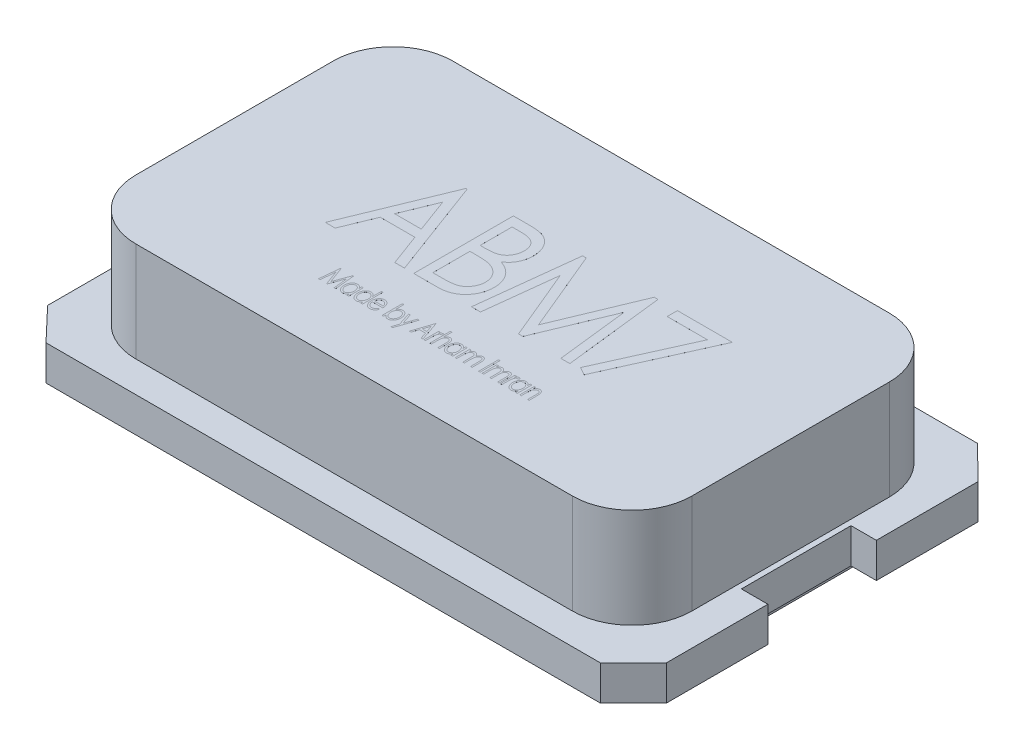
from build123d import *

# Parameters (mm, degrees)
SKETCH2_W             = 1.60281389
SKETCH2_H             = 2
BOSS_EXTRUDE3_DEPTH   = 0.05
BOSS_EXTRUDE3_2_DEPTH = 0.05
SKETCH2_6_W           = 1.60281389
SKETCH2_6_H           = 2
BOSS_EXTRUDE4_DEPTH   = 0.35
SKETCH4_W             = 1.60281389
SKETCH4_H             = 2
BOSS_EXTRUDE5_DEPTH   = 0.35
BOSS_EXTRUDE6_DEPTH   = 1
BOSS_EXTRUDE7_DEPTH   = 0.0001
SKETCH7_W             = 0.015384615
SKETCH7_H             = 0.2
BOSS_EXTRUDE8_DEPTH   = 0.0001


with BuildPart() as part:
    # Sketch2 → Boss-Extrude3 (new body)
    with BuildSketch(Plane(origin=(0, 0, 0), x_dir=(1, 0, 0), z_dir=(0, 1, 0))):
        with Locations((-2.017592262, -0.002943306)):
            Rectangle(SKETCH2_W, SKETCH2_H)
    extrude(amount=-BOSS_EXTRUDE3_DEPTH)



with BuildPart() as body_2:
    # Sketch2 → Boss-Extrude3 2 (new body)
    with BuildSketch(Plane(origin=(0, 0, 0), x_dir=(1, 0, 0), z_dir=(0, 1, 0))):
        with Locations((2.012956796, -0.000677208)):
            Rectangle(SKETCH2_W, SKETCH2_H)
    extrude(amount=-BOSS_EXTRUDE3_2_DEPTH)


with BuildPart() as body_3:
    # Sketch2<6> → Boss-Extrude4 (new body)
    with BuildSketch(Plane(origin=(0, 0, 0), x_dir=(1, 0, 0), z_dir=(0, 1, 0))):
        Polygon((-2.766899596, 1.9), (2.765342962, 1.9), (3.1, 1.569992929), (3.1, 0.55), (2.845363741, 0.55), (2.845363741, -0.55), (3.111544747, -0.55), (3.111544747, -1.57), (2.781544747, -1.9), (-2.783101382, -1.9), (-3.099891164, -1.566870993), (-3.099891164, -0.546870993), (-2.849999207, -0.546870993), (-2.849999207, 0.553129007), (-3.099999207, 0.553129002), (-3.099999207, 1.573129002), align=None)
        with Locations((-2.017592262, -0.002943306)):
            Rectangle(SKETCH2_6_W, SKETCH2_6_H, mode=Mode.SUBTRACT)
        with Locations((2.012956796, -0.000677208)):
            Rectangle(SKETCH2_6_W, SKETCH2_6_H, mode=Mode.SUBTRACT)
    extrude(amount=BOSS_EXTRUDE4_DEPTH)


with BuildPart() as part_1:
    add(part.part)

    add(body_2.part)  # Boss-Extrude5 merges body 2

    add(body_3.part)  # Boss-Extrude5 merges body 3
    # Sketch4 → Boss-Extrude5 (add)
    with BuildSketch(Plane(origin=(0, 0, 0), x_dir=(1, 0, 0), z_dir=(0, 1, 0))):
        with Locations((-2.017592262, -0.002943306)):
            Rectangle(SKETCH4_W, SKETCH4_H)
        with Locations((2.012956796, -0.000677208)):
            Rectangle(SKETCH4_W, SKETCH4_H)
    extrude(amount=BOSS_EXTRUDE5_DEPTH)

    # Sketch5 → Boss-Extrude6 (add)
    with BuildSketch(Plane(origin=(0, 0.35, 0), x_dir=(1, 0, 0), z_dir=(0, 1, 0))):
        with BuildLine():
            Line((-2.190920375, 1.59), (2.189363741, 1.59))
            ThreePointArc((2.189363741, 1.59), (2.61362781, 1.414264069), (2.789363741, 0.99))
            Line((2.789363741, 0.99), (2.789363741, -0.99))
            ThreePointArc((2.789363741, -0.99), (2.61362781, -1.414264069), (2.189363741, -1.59))
            Line((2.189363741, -1.59), (-2.190920375, -1.59))
            ThreePointArc((-2.190920375, -1.59), (-2.615184444, -1.414264069), (-2.790920375, -0.99))
            Line((-2.790920375, -0.99), (-2.790920375, 0.99))
            ThreePointArc((-2.790920375, 0.99), (-2.615184444, 1.414264069), (-2.190920375, 1.59))
        make_face()
    extrude(amount=BOSS_EXTRUDE6_DEPTH)

    # Sketch6 → Boss-Extrude7 (add)
    # profile 1 of 4: a face of its own
    with BuildSketch(Plane(origin=(0, 1.35, 0), x_dir=(1, 0, 0), z_dir=(0, 1, 0))):
        Polygon((-1.004768688, 0.547814016), (-0.632973816, -0.452185984), (-0.730329586, -0.452185984), (-0.84931997, -0.131673164), (-1.197477022, -0.131673164), (-1.328887278, -0.452185984), (-1.427845611, -0.452185984), (-1.017589201, 0.547814016), align=None)
        Polygon((-1.014784714, 0.313238695), (-1.155209393, -0.029109061), (-0.887581188, -0.029109061), align=None, mode=Mode.SUBTRACT)
    # profile 2 of 4: a face of its own
    with BuildSketch(Plane(origin=(0, 1.35, 0), x_dir=(1, 0, 0), z_dir=(0, 1, 0))):
        with BuildLine():
            Line((-0.540666124, 0.547814016), (-0.369993047, 0.547814016))
            add(Edge.make_bspline(
                [(-0.369993047, 0.547814016), (-0.361643741, 0.547762066), (-0.345399843, 0.547660997), (-0.321816103, 0.546166278), (-0.299735854, 0.544096142), (-0.279221729, 0.5408361), (-0.26016035, 0.536853016), (-0.242504845, 0.532152414), (-0.226347972, 0.526327791), (-0.206986598, 0.51728618), (-0.184919674, 0.503556166), (-0.161007022, 0.483566033), (-0.140609284, 0.459187762), (-0.123233782, 0.431524412), (-0.109333019, 0.401270873), (-0.099191173, 0.36898478), (-0.093070237, 0.335039209), (-0.092325508, 0.311794801), (-0.091948175, 0.300017541)],
                knots=[0, 0, 0, 0, 0.943162248, 1.8349585, 2.668974122, 3.447905888, 4.180328077, 4.868477066, 5.51045498, 6.117996276, 7.27997042, 8.436248577, 9.624427036, 10.855171045, 12.117669478, 13.375131133, 14.670055953, 16, 16, 16, 16], degree=3))
            add(Edge.make_bspline(
                [(-0.091948175, 0.300017541), (-0.092298031, 0.288979547), (-0.092984813, 0.267311489), (-0.098304413, 0.235550518), (-0.107157689, 0.205374639), (-0.119318226, 0.176838134), (-0.135033232, 0.150387105), (-0.15415621, 0.126453097), (-0.176654083, 0.105022476), (-0.193801738, 0.093260641), (-0.202525098, 0.087277157)],
                knots=[0, 0, 0, 0, 1.056727506, 2.074401545, 3.074053978, 4.06237172, 5.037358539, 6.011107225, 6.988209916, 8, 8, 8, 8], degree=3))
            add(Edge.make_bspline(
                [(-0.202525098, 0.087277157), (-0.191498188, 0.082911857), (-0.170360329, 0.074543867), (-0.141259083, 0.05977712), (-0.116132416, 0.04377158), (-0.094879174, 0.026257901), (-0.076870337, 0.007217369), (-0.060708473, -0.013103677), (-0.047290607, -0.035685714), (-0.035514963, -0.059724391), (-0.026438807, -0.085281101), (-0.019656603, -0.112013875), (-0.015933412, -0.139847995), (-0.015329912, -0.158773146), (-0.015025098, -0.168331818)],
                knots=[0, 0, 0, 0, 1.253473359, 2.402825568, 3.44468963, 4.397487603, 5.306318866, 6.211633052, 7.136718514, 8.0777245, 9.038026576, 9.998665997, 10.989170872, 12, 12, 12, 12], degree=3))
            add(Edge.make_bspline(
                [(-0.015025098, -0.168331818), (-0.015247524, -0.178092115), (-0.015684808, -0.197280683), (-0.019385332, -0.225446563), (-0.025377425, -0.252408107), (-0.033783661, -0.278296664), (-0.044986042, -0.302922456), (-0.058044909, -0.326752377), (-0.074187634, -0.348965885), (-0.091955903, -0.3701767), (-0.112015559, -0.389402621), (-0.133821437, -0.406342021), (-0.157533095, -0.420375221), (-0.182711715, -0.432139416), (-0.209679007, -0.441131279), (-0.238288154, -0.447421531), (-0.26843845, -0.451650057), (-0.289115358, -0.452004749), (-0.299680547, -0.452185984)],
                knots=[0, 0, 0, 0, 1.038509558, 2.041690987, 3.017614995, 3.975041845, 4.932626952, 5.89352943, 6.861815316, 7.850082867, 8.835279032, 9.81329694, 10.782286797, 11.761646577, 12.766261968, 13.800775556, 14.87627195, 16, 16, 16, 16], degree=3))
            Line((-0.299680547, -0.452185984), (-0.540666124, -0.452185984))
            Line((-0.540666124, -0.452185984), (-0.540666124, 0.547814016))
        make_face()
        with BuildLine():
            Line((-0.450922534, 0.445249913), (-0.450922534, 0.124737093))
            Line((-0.450922534, 0.124737093), (-0.40224465, 0.124737093))
            add(Edge.make_bspline(
                [(-0.40224465, 0.124737093), (-0.395099974, 0.12484974), (-0.381340567, 0.12506668), (-0.361348008, 0.125719725), (-0.342860918, 0.127452829), (-0.325777948, 0.129269493), (-0.310269049, 0.132115223), (-0.29625868, 0.135564979), (-0.283501764, 0.139207418), (-0.268730333, 0.145401569), (-0.251891385, 0.154532662), (-0.234357329, 0.168920575), (-0.218703679, 0.18566477), (-0.205593918, 0.205123339), (-0.195031249, 0.226573598), (-0.187117883, 0.249346017), (-0.182672432, 0.273470748), (-0.182023261, 0.289850441), (-0.181691765, 0.298214657)],
                knots=[0, 0, 0, 0, 1.068645243, 2.058025688, 2.990115549, 3.844744776, 4.626241161, 5.345550605, 6.002630039, 6.607150377, 7.738038243, 8.853076426, 9.983611551, 11.155164805, 12.347513366, 13.550642837, 14.749246986, 16, 16, 16, 16], degree=3))
            add(Edge.make_bspline(
                [(-0.181691765, 0.298214657), (-0.181784676, 0.30376349), (-0.181966667, 0.314632414), (-0.184045046, 0.330447628), (-0.18725326, 0.345390311), (-0.191574916, 0.359479782), (-0.197440487, 0.372550367), (-0.204538082, 0.384670203), (-0.212731054, 0.395998384), (-0.222450967, 0.406265798), (-0.233511102, 0.415514696), (-0.246024286, 0.423669627), (-0.260230325, 0.430107804), (-0.275694036, 0.435894855), (-0.292886864, 0.439889208), (-0.311456981, 0.443190585), (-0.331566132, 0.444911647), (-0.345417744, 0.445134778), (-0.352565163, 0.445249913)],
                knots=[0, 0, 0, 0, 1.033315509, 2.02403391, 2.965976521, 3.878877932, 4.764409291, 5.628620732, 6.492115432, 7.363461866, 8.255524103, 9.173498167, 10.136325718, 11.155690621, 12.24501133, 13.419065984, 14.668240628, 16, 16, 16, 16], degree=3))
            Line((-0.352565163, 0.445249913), (-0.450922534, 0.445249913))
        make_face(mode=Mode.SUBTRACT)
        with BuildLine():
            Line((-0.450922534, 0.02217299), (-0.450922534, -0.349621882))
            Line((-0.450922534, -0.349621882), (-0.342949778, -0.349621882))
            add(Edge.make_bspline(
                [(-0.342949778, -0.349621882), (-0.335270441, -0.349512331), (-0.320442073, -0.349300794), (-0.298988461, -0.348606206), (-0.279060068, -0.347046792), (-0.260779262, -0.344556103), (-0.244006906, -0.341926193), (-0.228919357, -0.338227325), (-0.215341983, -0.334171572), (-0.199491969, -0.327687898), (-0.181603702, -0.317791959), (-0.162609951, -0.302644863), (-0.14552896, -0.284945641), (-0.131334777, -0.264229668), (-0.119513461, -0.241888117), (-0.111097588, -0.218131729), (-0.105566358, -0.193560066), (-0.105035645, -0.176774983), (-0.104768688, -0.168331818)],
                knots=[0, 0, 0, 0, 1.081619098, 2.088545823, 3.022572722, 3.895065755, 4.686620152, 5.411945446, 6.081214222, 6.68019563, 7.821024448, 8.946046415, 10.090087698, 11.271885441, 12.47066001, 13.639667357, 14.812714956, 16, 16, 16, 16], degree=3))
            add(Edge.make_bspline(
                [(-0.104768688, -0.168331818), (-0.10519011, -0.157867245), (-0.106017209, -0.137329062), (-0.113750604, -0.107703368), (-0.126100963, -0.080121918), (-0.143519977, -0.055116464), (-0.164919818, -0.032787869), (-0.190409865, -0.014145396), (-0.219577646, 0.000706384), (-0.240862873, 0.007078614), (-0.251803945, 0.01035408)],
                knots=[0, 0, 0, 0, 1.002523699, 1.967592627, 2.916812078, 3.889001818, 4.876880315, 5.871365521, 6.905835296, 8, 8, 8, 8], degree=3))
            add(Edge.make_bspline(
                [(-0.251803945, 0.01035408), (-0.255732825, 0.011338995), (-0.264199466, 0.013461463), (-0.27813212, 0.015765134), (-0.294039201, 0.017738364), (-0.311955509, 0.019241186), (-0.331776836, 0.020777611), (-0.353698723, 0.021385775), (-0.377600811, 0.022092085), (-0.394231095, 0.022145382), (-0.402845611, 0.02217299)],
                knots=[0, 0, 0, 0, 0.639967164, 1.379113422, 2.229991931, 3.173071501, 4.220511108, 5.371654984, 6.638512572, 8, 8, 8, 8], degree=3))
            Line((-0.402845611, 0.02217299), (-0.450922534, 0.02217299))
        make_face(mode=Mode.SUBTRACT)
    # profile 3 of 4: a face of its own
    with BuildSketch(Plane(origin=(0, 1.35, 0), x_dir=(1, 0, 0), z_dir=(0, 1, 0))):
        Polygon((0.038821055, -0.452185984), (0.15380503, 0.547814016), (0.190263363, 0.547814016), (0.532410799, -0.272698805), (0.873155991, 0.547814016), (0.910816248, 0.547814016), (1.026000543, -0.452185984), (0.935655991, -0.452185984), (0.85292362, 0.265762734), (0.554846696, -0.452185984), (0.511176825, -0.452185984), (0.211897978, 0.265762734), (0.129365927, -0.452185984), align=None)
    # profile 4 of 4: a face of its own
    with BuildSketch(Plane(origin=(0, 1.35, 0), x_dir=(1, 0, 0), z_dir=(0, 1, 0))):
        Polygon((1.105487722, 0.547814016), (1.656769773, 0.547814016), (1.195231312, -0.47782701), (1.114301825, -0.433556177), (1.509734517, 0.445249913), (1.105487722, 0.445249913), align=None)
    extrude(amount=BOSS_EXTRUDE7_DEPTH)

    # Sketch7 → Boss-Extrude8 (add)
    # profile 1 of 16: a face of its own
    with BuildSketch(Plane(origin=(0, 1.35, 0), x_dir=(1, 0, 0), z_dir=(0, 1, 0))):
        Polygon((-0.97184186, -0.97604232), (-0.95241077, -0.77604232), (-0.946601475, -0.77604232), (-0.885944424, -0.940144884), (-0.825647949, -0.77604232), (-0.81959827, -0.77604232), (-0.800046988, -0.97604232), (-0.815471667, -0.97604232), (-0.829534167, -0.832452577), (-0.882258526, -0.97604232), (-0.889309808, -0.97604232), (-0.94235468, -0.832452577), (-0.956296988, -0.97604232), align=None)
    # profile 2 of 16: a face of its own
    with BuildSketch(Plane(origin=(0, 1.35, 0), x_dir=(1, 0, 0), z_dir=(0, 1, 0))):
        with BuildLine():
            Line((-0.669534167, -0.829888474), (-0.669534167, -0.97604232))
            Line((-0.669534167, -0.97604232), (-0.684918783, -0.97604232))
            Line((-0.684918783, -0.97604232), (-0.684918783, -0.950761871))
            add(Edge.make_bspline(
                [(-0.684918783, -0.950761871), (-0.686417347, -0.953042801), (-0.689310792, -0.957446846), (-0.694322465, -0.963222458), (-0.699543142, -0.968126754), (-0.705117948, -0.971998872), (-0.710960189, -0.974974411), (-0.717061639, -0.977044282), (-0.723413574, -0.978407906), (-0.727753575, -0.978539699), (-0.729950834, -0.978606423)],
                knots=[0, 0, 0, 0, 1.179334017, 2.277072125, 3.299058578, 4.27014761, 5.202761405, 6.125302315, 7.050876602, 8, 8, 8, 8], degree=3))
            add(Edge.make_bspline(
                [(-0.729950834, -0.978606423), (-0.731905333, -0.978535783), (-0.735775583, -0.978395903), (-0.741456385, -0.977319585), (-0.7469098, -0.975594457), (-0.752142854, -0.97314925), (-0.757155381, -0.970009173), (-0.761945469, -0.966169429), (-0.766495166, -0.961631411), (-0.770767705, -0.956475575), (-0.774649193, -0.950812496), (-0.778135414, -0.944838108), (-0.781015665, -0.938507339), (-0.783380757, -0.931884853), (-0.78522135, -0.924969223), (-0.786554271, -0.917765367), (-0.787305225, -0.910259702), (-0.787423032, -0.905157175), (-0.787482885, -0.902564756)],
                knots=[0, 0, 0, 0, 0.887872522, 1.758142578, 2.618128085, 3.481683386, 4.376005731, 5.300250685, 6.265959025, 7.291808604, 8.339055305, 9.383289759, 10.431679196, 11.495297482, 12.575994128, 13.680797244, 14.821693069, 16, 16, 16, 16], degree=3))
            add(Edge.make_bspline(
                [(-0.787482885, -0.902564756), (-0.787427175, -0.900025301), (-0.787317233, -0.895013775), (-0.786502881, -0.887646136), (-0.785175659, -0.880548768), (-0.783356134, -0.873727582), (-0.780928625, -0.867207793), (-0.777986157, -0.860966832), (-0.774547974, -0.854990266), (-0.770603273, -0.849374022), (-0.766283623, -0.844253642), (-0.761704086, -0.839721262), (-0.75689282, -0.83588408), (-0.75183232, -0.83278487), (-0.746599216, -0.830288254), (-0.741110596, -0.828567195), (-0.735397686, -0.827543943), (-0.731517507, -0.827398244), (-0.729550193, -0.827324371)],
                knots=[0, 0, 0, 0, 1.159290559, 2.287818926, 3.379660878, 4.453494628, 5.506844558, 6.551511375, 7.600493292, 8.650980421, 9.680735975, 10.655174849, 11.588394672, 12.48356998, 13.359156398, 14.228863471, 15.102004974, 16, 16, 16, 16], degree=3))
            add(Edge.make_bspline(
                [(-0.729550193, -0.827324371), (-0.727300678, -0.827408678), (-0.722855261, -0.827575282), (-0.716361021, -0.82891086), (-0.710236333, -0.83121836), (-0.704397137, -0.834304272), (-0.698904836, -0.838433047), (-0.693830984, -0.843625271), (-0.689043313, -0.849818796), (-0.686333261, -0.85449241), (-0.684918783, -0.856931743)],
                knots=[0, 0, 0, 0, 0.955142924, 1.887521798, 2.80119314, 3.727598216, 4.684104897, 5.707064902, 6.803231533, 8, 8, 8, 8], degree=3))
            Line((-0.684918783, -0.856931743), (-0.684918783, -0.829888474))
            Line((-0.684918783, -0.829888474), (-0.669534167, -0.829888474))
        make_face()
        with BuildLine():
            add(Edge.make_bspline(
                [(-0.728468462, -0.845273089), (-0.730413201, -0.845367121), (-0.734273849, -0.845553791), (-0.739931589, -0.847011862), (-0.745322333, -0.849430691), (-0.75044489, -0.852719808), (-0.755195261, -0.85687834), (-0.759441119, -0.861846519), (-0.76320459, -0.867561933), (-0.766337988, -0.873958255), (-0.76890055, -0.880815122), (-0.770725136, -0.887961153), (-0.771907511, -0.895300574), (-0.772034333, -0.900263211), (-0.77209827, -0.902765077)],
                knots=[0, 0, 0, 0, 0.876143593, 1.739298532, 2.615462818, 3.5308531, 4.474045836, 5.451821009, 6.468949931, 7.55154866, 8.656673038, 9.763764415, 10.872623107, 12, 12, 12, 12], degree=3))
            add(Edge.make_bspline(
                [(-0.77209827, -0.902765077), (-0.77203257, -0.905253233), (-0.771901903, -0.910201803), (-0.770738209, -0.917535942), (-0.768840162, -0.924696481), (-0.766273625, -0.931606622), (-0.763065002, -0.93804219), (-0.759337037, -0.943838359), (-0.755062518, -0.948865688), (-0.750289074, -0.95307015), (-0.7451955, -0.956464843), (-0.739815031, -0.958854836), (-0.734255437, -0.960387797), (-0.730454685, -0.960567555), (-0.72854859, -0.960657705)],
                knots=[0, 0, 0, 0, 1.119778423, 2.227071088, 3.334118807, 4.451051948, 5.540186051, 6.565939309, 7.546896586, 8.501209795, 9.421850429, 10.291284033, 11.143070857, 12, 12, 12, 12], degree=3))
            add(Edge.make_bspline(
                [(-0.72854859, -0.960657705), (-0.726630161, -0.96056313), (-0.722795494, -0.96037409), (-0.71713728, -0.958893176), (-0.711641711, -0.956515894), (-0.706422311, -0.953142842), (-0.701504748, -0.949077778), (-0.697190727, -0.944183484), (-0.693442271, -0.938674124), (-0.690371804, -0.932503966), (-0.687937281, -0.925808452), (-0.686183683, -0.918663708), (-0.685122586, -0.911103447), (-0.684987809, -0.905933638), (-0.684918783, -0.90328591)],
                knots=[0, 0, 0, 0, 0.862570292, 1.724155687, 2.61524019, 3.547403977, 4.511725999, 5.478125195, 6.473421915, 7.502977832, 8.571655993, 9.673787814, 10.808626144, 12, 12, 12, 12], degree=3))
            add(Edge.make_bspline(
                [(-0.684918783, -0.90328591), (-0.684954774, -0.901267653), (-0.685025492, -0.89730206), (-0.685655739, -0.891481138), (-0.686593345, -0.885905144), (-0.687949965, -0.880575574), (-0.689774767, -0.875523897), (-0.691930256, -0.870707542), (-0.694465016, -0.866132421), (-0.697407514, -0.861891679), (-0.700639695, -0.858031028), (-0.704026503, -0.854583314), (-0.707661292, -0.851724775), (-0.711466226, -0.84937737), (-0.715444046, -0.847493201), (-0.719650446, -0.84624596), (-0.7239995, -0.845383786), (-0.726968446, -0.845310245), (-0.728468462, -0.845273089)],
                knots=[0, 0, 0, 0, 1.20221804, 2.362190828, 3.48462824, 4.569282157, 5.633932456, 6.681042011, 7.71052723, 8.745747275, 9.751336919, 10.707874985, 11.620059176, 12.498976955, 13.367640915, 14.233493954, 15.107499117, 16, 16, 16, 16], degree=3))
        make_face(mode=Mode.SUBTRACT)
    # profile 3 of 16: a face of its own
    with BuildSketch(Plane(origin=(0, 1.35, 0), x_dir=(1, 0, 0), z_dir=(0, 1, 0))):
        with BuildLine():
            Line((-0.531329039, -0.770914115), (-0.531329039, -0.97604232))
            Line((-0.531329039, -0.97604232), (-0.546713655, -0.97604232))
            Line((-0.546713655, -0.97604232), (-0.546713655, -0.950761871))
            add(Edge.make_bspline(
                [(-0.546713655, -0.950761871), (-0.548271477, -0.953038827), (-0.551273083, -0.957426059), (-0.556355621, -0.963257465), (-0.561742889, -0.968115134), (-0.567441641, -0.972016893), (-0.573431421, -0.97496458), (-0.57967082, -0.977052881), (-0.58617199, -0.978406365), (-0.590617176, -0.978539184), (-0.592867501, -0.978606423)],
                knots=[0, 0, 0, 0, 1.172821272, 2.259788523, 3.281626752, 4.250638048, 5.188097464, 6.11145764, 7.043946874, 8, 8, 8, 8], degree=3))
            add(Edge.make_bspline(
                [(-0.592867501, -0.978606423), (-0.594875326, -0.978536339), (-0.598838314, -0.978398008), (-0.604652313, -0.977321235), (-0.610233891, -0.975586406), (-0.615608354, -0.973161603), (-0.620746456, -0.970023549), (-0.625623215, -0.96615931), (-0.630294676, -0.961638818), (-0.634681221, -0.956477449), (-0.638690709, -0.95082695), (-0.642247721, -0.94483869), (-0.645222421, -0.938518958), (-0.647616357, -0.931885148), (-0.649501726, -0.924971197), (-0.650870715, -0.91776687), (-0.651675195, -0.910262061), (-0.651785721, -0.905157502), (-0.65184186, -0.902564756)],
                knots=[0, 0, 0, 0, 0.903163779, 1.78263887, 2.651389892, 3.528335299, 4.429236434, 5.353843816, 6.32297284, 7.350379706, 8.397704944, 9.43776181, 10.480939894, 11.536168289, 12.607837322, 13.702913536, 14.833246301, 16, 16, 16, 16], degree=3))
            add(Edge.make_bspline(
                [(-0.65184186, -0.902564756), (-0.651785494, -0.900025374), (-0.651674257, -0.895013992), (-0.650869041, -0.887642821), (-0.649505464, -0.880539853), (-0.647580627, -0.873734107), (-0.64513821, -0.867195136), (-0.642097548, -0.860967131), (-0.638589514, -0.854975242), (-0.634516667, -0.849372269), (-0.63008305, -0.844246588), (-0.625381932, -0.839731424), (-0.620483822, -0.835869535), (-0.615297904, -0.832773098), (-0.609923082, -0.830296615), (-0.604294207, -0.828559686), (-0.598446284, -0.827547824), (-0.594473938, -0.827399377), (-0.59246686, -0.827324371)],
                knots=[0, 0, 0, 0, 1.147764703, 2.265073058, 3.347188514, 4.413563271, 5.458552615, 6.498034846, 7.542675396, 8.593229709, 9.624528646, 10.602280619, 11.535718512, 12.43746343, 13.326263971, 14.204609005, 15.092855845, 16, 16, 16, 16], degree=3))
            add(Edge.make_bspline(
                [(-0.59246686, -0.827324371), (-0.590162337, -0.8274145), (-0.585613618, -0.827592399), (-0.578957125, -0.829080921), (-0.572662489, -0.831553191), (-0.566699476, -0.834970281), (-0.561094375, -0.839344575), (-0.555863091, -0.844715168), (-0.550955557, -0.851010979), (-0.548157523, -0.855735657), (-0.546713655, -0.85817373)],
                knots=[0, 0, 0, 0, 0.951761596, 1.878609077, 2.803234748, 3.737825122, 4.709500238, 5.732190869, 6.829743151, 8, 8, 8, 8], degree=3))
            Line((-0.546713655, -0.85817373), (-0.546713655, -0.770914115))
            Line((-0.546713655, -0.770914115), (-0.531329039, -0.770914115))
        make_face()
        with BuildLine():
            add(Edge.make_bspline(
                [(-0.591545385, -0.845273089), (-0.59354392, -0.845365181), (-0.597497769, -0.845547371), (-0.603304472, -0.847028609), (-0.60886168, -0.849402655), (-0.614121023, -0.85273105), (-0.619027148, -0.856859104), (-0.623400882, -0.861830295), (-0.627233434, -0.867568841), (-0.630507485, -0.873942262), (-0.633128092, -0.880814168), (-0.635068289, -0.887948581), (-0.636210255, -0.895303228), (-0.636374454, -0.900263877), (-0.636457244, -0.902765077)],
                knots=[0, 0, 0, 0, 0.889986747, 1.760726957, 2.654291155, 3.574435545, 4.525048729, 5.503537062, 6.515786069, 7.594227279, 8.69108243, 9.788712926, 10.885050875, 12, 12, 12, 12], degree=3))
            add(Edge.make_bspline(
                [(-0.636457244, -0.902765077), (-0.636373943, -0.905252912), (-0.636208291, -0.910200171), (-0.635067435, -0.91754114), (-0.633123631, -0.924706034), (-0.630468051, -0.93160895), (-0.627186762, -0.938056618), (-0.62333472, -0.943858657), (-0.618895196, -0.948856435), (-0.614000721, -0.953088643), (-0.608747198, -0.956467931), (-0.603208902, -0.958857036), (-0.597490193, -0.960387825), (-0.593584727, -0.960567546), (-0.591625514, -0.960657705)],
                knots=[0, 0, 0, 0, 1.107134717, 2.201624853, 3.297405357, 4.405640407, 5.487550432, 6.511274564, 7.496504317, 8.453227042, 9.383191759, 10.264331864, 11.129285807, 12, 12, 12, 12], degree=3))
            add(Edge.make_bspline(
                [(-0.591625514, -0.960657705), (-0.589653946, -0.960563103), (-0.585714395, -0.960374071), (-0.579896949, -0.958895766), (-0.574244096, -0.956518064), (-0.568863671, -0.953161374), (-0.563829892, -0.949065285), (-0.559340787, -0.944217072), (-0.555530139, -0.938664085), (-0.552319383, -0.932520647), (-0.549805958, -0.925816798), (-0.548023013, -0.91866524), (-0.546905902, -0.911106765), (-0.546778751, -0.905934126), (-0.546713655, -0.90328591)],
                knots=[0, 0, 0, 0, 0.876208669, 1.750824835, 2.653383159, 3.594851912, 4.561677096, 5.532800273, 6.523229602, 7.548932705, 8.609302186, 9.700041332, 10.822498838, 12, 12, 12, 12], degree=3))
            add(Edge.make_bspline(
                [(-0.546713655, -0.90328591), (-0.54675021, -0.90126768), (-0.546822035, -0.897302139), (-0.547444534, -0.891478529), (-0.548412813, -0.885894901), (-0.549891404, -0.880590882), (-0.551668017, -0.875503165), (-0.553933218, -0.87070713), (-0.556540034, -0.866128574), (-0.55956656, -0.861891264), (-0.562874406, -0.858012824), (-0.566384139, -0.854594756), (-0.570102966, -0.851708658), (-0.574026618, -0.849377557), (-0.578122691, -0.847491605), (-0.58244857, -0.846245926), (-0.586930243, -0.845381311), (-0.589991992, -0.845309515), (-0.591545385, -0.845273089)],
                knots=[0, 0, 0, 0, 1.188172481, 2.334593263, 3.445282313, 4.521295281, 5.57350723, 6.614936672, 7.640145624, 8.672298908, 9.676294346, 10.638484653, 11.55241243, 12.441226742, 13.321194475, 14.199508958, 15.086512205, 16, 16, 16, 16], degree=3))
        make_face(mode=Mode.SUBTRACT)
    # profile 4 of 16: a face of its own
    with BuildSketch(Plane(origin=(0, 1.35, 0), x_dir=(1, 0, 0), z_dir=(0, 1, 0))):
        with BuildLine():
            Line((-0.41323609, -0.929888474), (-0.400816219, -0.938261871))
            add(Edge.make_bspline(
                [(-0.400816219, -0.938261871), (-0.401849482, -0.940509889), (-0.403847553, -0.944856985), (-0.407325304, -0.950887324), (-0.410976002, -0.956284828), (-0.414946001, -0.960977065), (-0.419143104, -0.965058315), (-0.423579057, -0.968601655), (-0.428243288, -0.971678872), (-0.433194144, -0.97421961), (-0.438448582, -0.9761992), (-0.444025753, -0.977597384), (-0.449934894, -0.978454176), (-0.453991691, -0.978554937), (-0.456064616, -0.978606423)],
                knots=[0, 0, 0, 0, 1.220827052, 2.360770422, 3.432396173, 4.43356285, 5.389352001, 6.318085998, 7.232386503, 8.143496222, 9.059435408, 9.998062091, 10.977058348, 12, 12, 12, 12], degree=3))
            add(Edge.make_bspline(
                [(-0.456064616, -0.978606423), (-0.458352848, -0.97854069), (-0.462835744, -0.978411911), (-0.469371996, -0.977296754), (-0.475532746, -0.97551638), (-0.481292127, -0.972953401), (-0.486662271, -0.969678776), (-0.491658385, -0.965683528), (-0.496253419, -0.960954248), (-0.500356113, -0.955554555), (-0.504042291, -0.949742552), (-0.507294244, -0.943676184), (-0.510094153, -0.937426565), (-0.512257923, -0.930940388), (-0.514059621, -0.9243283), (-0.515280835, -0.917504191), (-0.516076543, -0.910503107), (-0.516159165, -0.905758742), (-0.516200834, -0.903366038)],
                knots=[0, 0, 0, 0, 1.021793171, 2.001803894, 2.953445749, 3.880428937, 4.809656477, 5.756478151, 6.731242877, 7.748128213, 8.781064043, 9.803553923, 10.821419221, 11.836639958, 12.855624059, 13.880896041, 14.931282125, 16, 16, 16, 16], degree=3))
            add(Edge.make_bspline(
                [(-0.516200834, -0.903366038), (-0.516165581, -0.901120988), (-0.516095767, -0.896674911), (-0.515441563, -0.890100097), (-0.514347515, -0.883706952), (-0.51288426, -0.877485887), (-0.510945731, -0.871466827), (-0.508612237, -0.865626935), (-0.505868227, -0.859957309), (-0.503677307, -0.856367478), (-0.502579039, -0.854567961)],
                knots=[0, 0, 0, 0, 1.048900473, 2.077233192, 3.083708021, 4.078193164, 5.06105756, 6.035665036, 7.01531453, 8, 8, 8, 8], degree=3))
            add(Edge.make_bspline(
                [(-0.502579039, -0.854567961), (-0.50111048, -0.852415059), (-0.498254491, -0.848228192), (-0.493409333, -0.842599297), (-0.488091969, -0.837921947), (-0.482472439, -0.83401115), (-0.476421511, -0.831042109), (-0.470043504, -0.828824618), (-0.463256509, -0.827593979), (-0.458619977, -0.827415186), (-0.456264937, -0.827324371)],
                knots=[0, 0, 0, 0, 1.111002694, 2.160628283, 3.157224189, 4.124064232, 5.071603655, 6.022611646, 6.995622377, 8, 8, 8, 8], degree=3))
            add(Edge.make_bspline(
                [(-0.456264937, -0.827324371), (-0.45382737, -0.827401018), (-0.449045869, -0.827551367), (-0.44208017, -0.828975958), (-0.435495768, -0.831213901), (-0.429288757, -0.834383571), (-0.423474425, -0.838481079), (-0.41805768, -0.843495031), (-0.413004854, -0.849388683), (-0.41009003, -0.853812015), (-0.408588655, -0.856090397)],
                knots=[0, 0, 0, 0, 1.000931688, 1.963414985, 2.909556389, 3.852315515, 4.817877967, 5.824154561, 6.879259348, 8, 8, 8, 8], degree=3))
            add(Edge.make_bspline(
                [(-0.408588655, -0.856090397), (-0.407573912, -0.857825488), (-0.40553036, -0.861319723), (-0.402917587, -0.866889469), (-0.400730031, -0.872777504), (-0.398916484, -0.878975666), (-0.397532362, -0.885487999), (-0.396487255, -0.892308375), (-0.395837119, -0.899454072), (-0.395738381, -0.904326209), (-0.395688014, -0.906811551)],
                knots=[0, 0, 0, 0, 0.909842459, 1.832298384, 2.781425176, 3.751643499, 4.753898402, 5.793881984, 6.874629437, 8, 8, 8, 8], degree=3))
            Line((-0.395688014, -0.906811551), (-0.500816219, -0.906811551))
            add(Edge.make_bspline(
                [(-0.500816219, -0.906811551), (-0.500753674, -0.908736868), (-0.50063081, -0.912519034), (-0.499922923, -0.918046606), (-0.498906851, -0.923319265), (-0.497453286, -0.928301116), (-0.495642616, -0.933017667), (-0.493483264, -0.937475377), (-0.490939836, -0.94167668), (-0.488046532, -0.945572322), (-0.484842702, -0.949076696), (-0.481479969, -0.952199288), (-0.477891833, -0.954824702), (-0.474109916, -0.956954663), (-0.470147344, -0.958626425), (-0.465996456, -0.959765734), (-0.461674837, -0.96052973), (-0.458725556, -0.960614578), (-0.457226475, -0.960657705)],
                knots=[0, 0, 0, 0, 1.199307391, 2.355965805, 3.466971799, 4.54108325, 5.583878082, 6.610723878, 7.622224514, 8.638775178, 9.628106183, 10.57603663, 11.492831415, 12.390519048, 13.274221942, 14.164361782, 15.066969552, 16, 16, 16, 16], degree=3))
            add(Edge.make_bspline(
                [(-0.457226475, -0.960657705), (-0.455768586, -0.960621642), (-0.45285195, -0.960549495), (-0.448513954, -0.959887679), (-0.444242738, -0.958787472), (-0.440068966, -0.957322283), (-0.436070747, -0.955486459), (-0.432359182, -0.953332684), (-0.428953307, -0.950902606), (-0.425763319, -0.948136558), (-0.422650025, -0.944780264), (-0.419639308, -0.940556635), (-0.416338505, -0.93558963), (-0.414314303, -0.931869853), (-0.41323609, -0.929888474)],
                knots=[0, 0, 0, 0, 0.922983319, 1.846509136, 2.771776543, 3.713485408, 4.644573013, 5.554242718, 6.42743124, 7.290813438, 8.224586841, 9.319181914, 10.572033221, 12, 12, 12, 12], degree=3))
        make_face()
        with BuildLine():
            add(Edge.make_bspline(
                [(-0.411072629, -0.888862833), (-0.411594205, -0.88648884), (-0.412591806, -0.881948189), (-0.414642799, -0.875592631), (-0.417017505, -0.869974046), (-0.419838193, -0.865090436), (-0.422995975, -0.860738584), (-0.426677695, -0.856935068), (-0.430792361, -0.853528159), (-0.435345394, -0.850650858), (-0.440137171, -0.848215625), (-0.445176941, -0.846546293), (-0.450313463, -0.845436821), (-0.453801983, -0.845327615), (-0.455543783, -0.845273089)],
                knots=[0, 0, 0, 0, 1.287691299, 2.462920814, 3.53458933, 4.514423943, 5.445998536, 6.37719655, 7.312528589, 8.270749586, 9.226771865, 10.15349307, 11.078049035, 12, 12, 12, 12], degree=3))
            add(Edge.make_bspline(
                [(-0.455543783, -0.845273089), (-0.456975091, -0.845307739), (-0.459799207, -0.845376106), (-0.463953616, -0.846035015), (-0.467935016, -0.847130019), (-0.471796451, -0.848607706), (-0.475456488, -0.850604055), (-0.479035391, -0.852925026), (-0.482398112, -0.855748791), (-0.484462127, -0.85788745), (-0.485511732, -0.858975013)],
                knots=[0, 0, 0, 0, 1.010500647, 1.993818758, 2.961858883, 3.923627339, 4.906945451, 5.901198905, 6.932705779, 8, 8, 8, 8], degree=3))
            add(Edge.make_bspline(
                [(-0.485511732, -0.858975013), (-0.48626162, -0.85984422), (-0.487800944, -0.861628474), (-0.489863864, -0.864601921), (-0.491794908, -0.86787389), (-0.493603339, -0.871459861), (-0.495270941, -0.875368647), (-0.496789515, -0.879583742), (-0.4981609, -0.884105308), (-0.498934487, -0.887243011), (-0.499333847, -0.888862833)],
                knots=[0, 0, 0, 0, 0.827595728, 1.698834691, 2.605819489, 3.566513017, 4.593589227, 5.669252772, 6.796764119, 8, 8, 8, 8], degree=3))
            Line((-0.499333847, -0.888862833), (-0.411072629, -0.888862833))
        make_face(mode=Mode.SUBTRACT)
    # profile 5 of 16: a face of its own
    with BuildSketch(Plane(origin=(0, 1.35, 0), x_dir=(1, 0, 0), z_dir=(0, 1, 0))):
        with BuildLine():
            Line((-0.334662373, -0.97604232), (-0.334662373, -0.770914115))
            Line((-0.334662373, -0.770914115), (-0.319277757, -0.770914115))
            Line((-0.319277757, -0.770914115), (-0.319277757, -0.85641091))
            add(Edge.make_bspline(
                [(-0.319277757, -0.85641091), (-0.317761519, -0.854093831), (-0.314842645, -0.849633278), (-0.309857134, -0.843695533), (-0.304650131, -0.838631558), (-0.299124599, -0.834491194), (-0.293294331, -0.831286632), (-0.287202586, -0.828985051), (-0.280828447, -0.827559647), (-0.276483281, -0.827403394), (-0.27428577, -0.827324371)],
                knots=[0, 0, 0, 0, 1.183408433, 2.278150912, 3.308211732, 4.283751013, 5.221855129, 6.1437005, 7.061200657, 8, 8, 8, 8], degree=3))
            add(Edge.make_bspline(
                [(-0.27428577, -0.827324371), (-0.27233136, -0.827395191), (-0.268461286, -0.827535426), (-0.262779187, -0.828609128), (-0.257319065, -0.830347741), (-0.252067659, -0.832758258), (-0.247076913, -0.835936587), (-0.242290621, -0.839759631), (-0.237738451, -0.844297834), (-0.233477541, -0.849469821), (-0.229530988, -0.855091658), (-0.226120369, -0.861116929), (-0.223175668, -0.86740026), (-0.220819477, -0.874007072), (-0.218968689, -0.880892936), (-0.217646823, -0.888072648), (-0.216888978, -0.895563931), (-0.216772823, -0.900653342), (-0.216713655, -0.903245846)],
                knots=[0, 0, 0, 0, 0.888664965, 1.759711752, 2.620464811, 3.49030315, 4.380275418, 5.305345277, 6.271915529, 7.298680698, 8.350324717, 9.392467512, 10.444339629, 11.50318869, 12.578982071, 13.684771244, 14.820641409, 16, 16, 16, 16], degree=3))
            add(Edge.make_bspline(
                [(-0.216713655, -0.903245846), (-0.216768636, -0.90579874), (-0.216876861, -0.910823794), (-0.217698575, -0.918216877), (-0.219013723, -0.925330245), (-0.220849634, -0.932173113), (-0.223257336, -0.938713784), (-0.226214154, -0.944961718), (-0.229642472, -0.950954118), (-0.233638208, -0.956543953), (-0.237950521, -0.961678883), (-0.242533133, -0.9662091), (-0.24734363, -0.970046823), (-0.252404324, -0.973145897), (-0.257637378, -0.975642547), (-0.263126011, -0.977363597), (-0.268838918, -0.978386852), (-0.272719097, -0.978532551), (-0.274686411, -0.978606423)],
                knots=[0, 0, 0, 0, 1.163832864, 2.290859305, 3.387233713, 4.459638328, 5.517298712, 6.560575213, 7.60816107, 8.660761018, 9.6891461, 10.662288122, 11.594265949, 12.488249894, 13.36267102, 14.231220626, 15.103200089, 16, 16, 16, 16], degree=3))
            add(Edge.make_bspline(
                [(-0.274686411, -0.978606423), (-0.276922755, -0.978522567), (-0.281342071, -0.978356857), (-0.287806967, -0.977012183), (-0.293910527, -0.974720945), (-0.299740807, -0.971619812), (-0.305184897, -0.967454156), (-0.310314979, -0.962295145), (-0.315088272, -0.956082782), (-0.317844975, -0.951421649), (-0.319277757, -0.948999051)],
                knots=[0, 0, 0, 0, 0.950756707, 1.878822988, 2.793721063, 3.716364242, 4.677569045, 5.69787768, 6.803484299, 8, 8, 8, 8], degree=3))
            Line((-0.319277757, -0.948999051), (-0.319277757, -0.97604232))
            Line((-0.319277757, -0.97604232), (-0.334662373, -0.97604232))
        make_face()
        with BuildLine():
            add(Edge.make_bspline(
                [(-0.275728078, -0.960657705), (-0.273783197, -0.960563872), (-0.269922269, -0.960377596), (-0.26426662, -0.958916586), (-0.25887802, -0.956513816), (-0.253787331, -0.953182432), (-0.248998724, -0.949082065), (-0.244800879, -0.944067402), (-0.241037418, -0.938380419), (-0.237899585, -0.931994774), (-0.235285417, -0.925164507), (-0.233479407, -0.918021151), (-0.232285342, -0.910697796), (-0.232161082, -0.905747932), (-0.23209827, -0.903245846)],
                knots=[0, 0, 0, 0, 0.877142563, 1.741281662, 2.618444942, 3.529808426, 4.478626649, 5.453591758, 6.4718804, 7.550317954, 8.658819177, 9.767172848, 10.871337684, 12, 12, 12, 12], degree=3))
            add(Edge.make_bspline(
                [(-0.23209827, -0.903245846), (-0.232164229, -0.90074442), (-0.232295413, -0.895769449), (-0.233453216, -0.88840734), (-0.235357012, -0.88123453), (-0.237922121, -0.874323594), (-0.241133955, -0.867890594), (-0.244856012, -0.862078279), (-0.249174712, -0.857076185), (-0.253941427, -0.85287309), (-0.259007133, -0.849454233), (-0.264371427, -0.847085723), (-0.269886811, -0.84554525), (-0.273648203, -0.845363773), (-0.275527757, -0.845273089)],
                knots=[0, 0, 0, 0, 1.12643722, 2.240318849, 3.348008215, 4.465588733, 5.5553541, 6.581701888, 7.567147922, 8.522014253, 9.438164137, 10.308101667, 11.15456436, 12, 12, 12, 12], degree=3))
            add(Edge.make_bspline(
                [(-0.275527757, -0.845273089), (-0.277446922, -0.845364821), (-0.281299321, -0.845548957), (-0.286961431, -0.847082487), (-0.292491922, -0.849458886), (-0.297733777, -0.852855933), (-0.302634707, -0.856989462), (-0.307017385, -0.861837624), (-0.310708027, -0.867411277), (-0.313829191, -0.873564361), (-0.316242048, -0.880261123), (-0.318025134, -0.887370567), (-0.319069712, -0.894894863), (-0.319207409, -0.900050823), (-0.319277757, -0.902684948)],
                knots=[0, 0, 0, 0, 0.861814427, 1.729945957, 2.620249608, 3.559885628, 4.527229284, 5.496788823, 6.487852805, 7.52457425, 8.592315935, 9.6818256, 10.815669478, 12, 12, 12, 12], degree=3))
            add(Edge.make_bspline(
                [(-0.319277757, -0.902684948), (-0.319242212, -0.90470333), (-0.31917237, -0.90866917), (-0.318535797, -0.914488316), (-0.317620503, -0.920074063), (-0.31618207, -0.925379582), (-0.314436405, -0.930456545), (-0.312261831, -0.935261718), (-0.309733284, -0.939839434), (-0.306786459, -0.944076802), (-0.303570972, -0.947940668), (-0.300155885, -0.951346574), (-0.296536948, -0.954207723), (-0.292729872, -0.956552981), (-0.288752611, -0.958437711), (-0.284546062, -0.959684803), (-0.280197048, -0.960547016), (-0.277228096, -0.960620552), (-0.275728078, -0.960657705)],
                knots=[0, 0, 0, 0, 1.202687674, 2.363113594, 3.485989475, 4.573080044, 5.635495296, 6.683013894, 7.712901271, 8.748525714, 9.754508181, 10.70580767, 11.618348197, 12.497609316, 13.366612611, 14.232803886, 15.10715047, 16, 16, 16, 16], degree=3))
        make_face(mode=Mode.SUBTRACT)
    # profile 6 of 16: a face of its own
    with BuildSketch(Plane(origin=(0, 1.35, 0), x_dir=(1, 0, 0), z_dir=(0, 1, 0))):
        Polygon((-0.214405962, -0.829888474), (-0.197579039, -0.829888474), (-0.161561411, -0.939704179), (-0.123540578, -0.829888474), (-0.106713655, -0.829888474), (-0.175944424, -1.029888474), (-0.192771347, -1.029888474), (-0.170215257, -0.964624051), align=None)
    # profile 7 of 16: a face of its own
    with BuildSketch(Plane(origin=(0, 1.35, 0), x_dir=(1, 0, 0), z_dir=(0, 1, 0))):
        Polygon((0.00815814, -0.77604232), (0.074824807, -0.97604232), (0.058078012, -0.97604232), (0.036723845, -0.911939756), (-0.022971667, -0.911939756), (-0.044325834, -0.97604232), (-0.061072629, -0.97604232), (0.005594038, -0.77604232), align=None)
        Polygon((0.006876089, -0.822436551), (-0.016120706, -0.891426936), (0.029872884, -0.891426936), align=None, mode=Mode.SUBTRACT)
    # profile 8 of 16: a face of its own
    with BuildSketch(Plane(origin=(0, 1.35, 0), x_dir=(1, 0, 0), z_dir=(0, 1, 0))):
        with BuildLine():
            Line((0.08738891, -0.829888474), (0.102773525, -0.829888474))
            Line((0.102773525, -0.829888474), (0.102773525, -0.851402897))
            add(Edge.make_bspline(
                [(0.102773525, -0.851402897), (0.103839621, -0.849410149), (0.105856398, -0.845640387), (0.109160347, -0.840537911), (0.112627807, -0.836365464), (0.116165688, -0.833013628), (0.119839842, -0.830480532), (0.123567867, -0.82864183), (0.127418496, -0.827545515), (0.130010547, -0.827397805), (0.131299166, -0.827324371)],
                knots=[0, 0, 0, 0, 1.379662333, 2.609962634, 3.70410508, 4.684907555, 5.576060405, 6.418504135, 7.213771616, 8, 8, 8, 8], degree=3))
            add(Edge.make_bspline(
                [(0.131299166, -0.827324371), (0.132293651, -0.827393902), (0.13436186, -0.827538504), (0.137480219, -0.828524981), (0.140687587, -0.830117707), (0.142723348, -0.831566667), (0.143799166, -0.832332384)],
                knots=[0, 0, 0, 0, 0.871477558, 1.812392457, 2.843937376, 4, 4, 4, 4], degree=3))
            Line((0.143799166, -0.832332384), (0.136146922, -0.847877256))
            add(Edge.make_bspline(
                [(0.136146922, -0.847877256), (0.135443792, -0.847494298), (0.134126081, -0.84677661), (0.132204228, -0.845901266), (0.130417951, -0.845384286), (0.129271952, -0.845308564), (0.128735063, -0.845273089)],
                knots=[0, 0, 0, 0, 1.210081042, 2.267767691, 3.188466361, 4, 4, 4, 4], degree=3))
            add(Edge.make_bspline(
                [(0.128735063, -0.845273089), (0.127572405, -0.845370522), (0.125173764, -0.845571533), (0.121687882, -0.847148238), (0.118330786, -0.849641574), (0.115032138, -0.85303583), (0.11198451, -0.857467709), (0.109318106, -0.862951962), (0.107050867, -0.869479793), (0.105957405, -0.87423986), (0.105377692, -0.876763474)],
                knots=[0, 0, 0, 0, 0.662811327, 1.36742251, 2.149178632, 3.045221645, 4.059512961, 5.209918752, 6.520801127, 8, 8, 8, 8], degree=3))
            add(Edge.make_bspline(
                [(0.105377692, -0.876763474), (0.105164689, -0.877923432), (0.104691629, -0.880499599), (0.104220541, -0.884798291), (0.103714474, -0.889883104), (0.103388813, -0.895764868), (0.103105124, -0.902429204), (0.102913884, -0.909882233), (0.102793568, -0.918135927), (0.102780409, -0.923905518), (0.102773525, -0.92692373)],
                knots=[0, 0, 0, 0, 0.562696875, 1.24970202, 2.062772353, 3.001466433, 4.060447458, 5.246391252, 6.559520794, 8, 8, 8, 8], degree=3))
            Line((0.102773525, -0.92692373), (0.102773525, -0.97604232))
            Line((0.102773525, -0.97604232), (0.08738891, -0.97604232))
            Line((0.08738891, -0.97604232), (0.08738891, -0.829888474))
        make_face()
    # profile 9 of 16: a face of its own
    with BuildSketch(Plane(origin=(0, 1.35, 0), x_dir=(1, 0, 0), z_dir=(0, 1, 0))):
        with BuildLine():
            Line((0.146106858, -0.770914115), (0.161491474, -0.770914115))
            Line((0.161491474, -0.770914115), (0.161491474, -0.857492641))
            add(Edge.make_bspline(
                [(0.161491474, -0.857492641), (0.162876441, -0.855100768), (0.165531096, -0.850516113), (0.170055588, -0.844355066), (0.174714397, -0.83908875), (0.17965627, -0.834810219), (0.184820452, -0.831480067), (0.190213023, -0.829063553), (0.195844293, -0.827611966), (0.199677795, -0.827420273), (0.20159564, -0.827324371)],
                knots=[0, 0, 0, 0, 1.256690491, 2.408778505, 3.471454159, 4.449464431, 5.373097068, 6.257150511, 7.128077468, 8, 8, 8, 8], degree=3))
            add(Edge.make_bspline(
                [(0.20159564, -0.827324371), (0.203541569, -0.82742586), (0.207387857, -0.82762646), (0.212986189, -0.829194188), (0.218183095, -0.831877384), (0.223000409, -0.835501075), (0.227289572, -0.840022582), (0.23113192, -0.845217988), (0.234163204, -0.851238383), (0.236289322, -0.856728174), (0.237650157, -0.861644051), (0.238558294, -0.865870702), (0.239318517, -0.870591171), (0.239899119, -0.875807371), (0.240370577, -0.881512496), (0.240739947, -0.887710164), (0.240924287, -0.894390557), (0.240960119, -0.899012316), (0.240978653, -0.901402897)],
                knots=[0, 0, 0, 0, 0.996176206, 1.969024424, 2.951356124, 3.977766322, 5.042421952, 6.134626154, 7.27621498, 8.484766679, 9.145542465, 9.887750523, 10.698838309, 11.594295832, 12.576246137, 13.63182529, 14.775074044, 16, 16, 16, 16], degree=3))
            Line((0.240978653, -0.901402897), (0.240978653, -0.97604232))
            Line((0.240978653, -0.97604232), (0.225594038, -0.97604232))
            Line((0.225594038, -0.97604232), (0.225594038, -0.90729232))
            add(Edge.make_bspline(
                [(0.225594038, -0.90729232), (0.225578726, -0.905302501), (0.225549439, -0.901496463), (0.225538258, -0.896046879), (0.225403755, -0.891105709), (0.225254235, -0.886684505), (0.225050782, -0.882784714), (0.224831977, -0.879401838), (0.224508227, -0.876545159), (0.224261852, -0.87481323), (0.22415173, -0.874039115)],
                knots=[0, 0, 0, 0, 1.433671176, 2.74226285, 3.926088526, 4.994794622, 5.929342253, 6.739627381, 7.436655691, 8, 8, 8, 8], degree=3))
            add(Edge.make_bspline(
                [(0.22415173, -0.874039115), (0.223709952, -0.871782621), (0.222871855, -0.867501831), (0.220874359, -0.861606632), (0.218358593, -0.856583897), (0.215286883, -0.852463697), (0.211711781, -0.849186559), (0.207546376, -0.846909891), (0.202888593, -0.845491532), (0.199602903, -0.845347375), (0.197909743, -0.845273089)],
                knots=[0, 0, 0, 0, 1.286018597, 2.439703376, 3.472813688, 4.417745281, 5.301809853, 6.165149782, 7.05447716, 8, 8, 8, 8], degree=3))
            add(Edge.make_bspline(
                [(0.197909743, -0.845273089), (0.196905982, -0.845300772), (0.194911263, -0.845355784), (0.19196147, -0.845894946), (0.189108926, -0.846794948), (0.186300426, -0.847983524), (0.183640214, -0.849642046), (0.180951201, -0.851491846), (0.178450689, -0.853819755), (0.175178151, -0.857300554), (0.171487513, -0.862236275), (0.167929892, -0.868880434), (0.165095484, -0.876152476), (0.163984219, -0.881323955), (0.163414551, -0.883975013)],
                knots=[0, 0, 0, 0, 0.644825769, 1.28142587, 1.919587189, 2.565555052, 3.235497232, 3.931132674, 4.660544456, 5.425856618, 7.00215079, 8.604141558, 10.259179793, 12, 12, 12, 12], degree=3))
            add(Edge.make_bspline(
                [(0.163414551, -0.883975013), (0.163261142, -0.884948978), (0.162925755, -0.887078296), (0.162531699, -0.890565943), (0.162231053, -0.894629654), (0.161940621, -0.899249926), (0.161761664, -0.904447049), (0.161587808, -0.910189237), (0.161524415, -0.916506951), (0.161502782, -0.920900768), (0.161491474, -0.923197769)],
                knots=[0, 0, 0, 0, 0.601974854, 1.316059127, 2.1422104, 3.089815509, 4.142494093, 5.317148409, 6.597457965, 8, 8, 8, 8], degree=3))
            Line((0.161491474, -0.923197769), (0.161491474, -0.97604232))
            Line((0.161491474, -0.97604232), (0.146106858, -0.97604232))
            Line((0.146106858, -0.97604232), (0.146106858, -0.770914115))
        make_face()
    # profile 10 of 16: a face of its own
    with BuildSketch(Plane(origin=(0, 1.35, 0), x_dir=(1, 0, 0), z_dir=(0, 1, 0))):
        with BuildLine():
            Line((0.374055576, -0.829888474), (0.374055576, -0.97604232))
            Line((0.374055576, -0.97604232), (0.358670961, -0.97604232))
            Line((0.358670961, -0.97604232), (0.358670961, -0.950761871))
            add(Edge.make_bspline(
                [(0.358670961, -0.950761871), (0.357172397, -0.953042801), (0.354278951, -0.957446846), (0.349267279, -0.963222458), (0.344046602, -0.968126754), (0.338471796, -0.971998872), (0.332629554, -0.974974411), (0.326528105, -0.977044282), (0.32017617, -0.978407906), (0.315836169, -0.978539699), (0.31363891, -0.978606423)],
                knots=[0, 0, 0, 0, 1.179334017, 2.277072125, 3.299058578, 4.27014761, 5.202761405, 6.125302315, 7.050876602, 8, 8, 8, 8], degree=3))
            add(Edge.make_bspline(
                [(0.31363891, -0.978606423), (0.31168441, -0.978535783), (0.30781416, -0.978395903), (0.302133359, -0.977319585), (0.296679944, -0.975594457), (0.291446889, -0.97314925), (0.286434362, -0.970009173), (0.281644275, -0.966169429), (0.277094578, -0.961631411), (0.272822039, -0.956475575), (0.268940551, -0.950812496), (0.265454329, -0.944838108), (0.262574079, -0.938507339), (0.260208987, -0.931884853), (0.258368393, -0.924969223), (0.257035473, -0.917765367), (0.256284518, -0.910259702), (0.256166712, -0.905157175), (0.256106858, -0.902564756)],
                knots=[0, 0, 0, 0, 0.887872522, 1.758142578, 2.618128085, 3.481683386, 4.376005731, 5.300250685, 6.265959025, 7.291808604, 8.339055305, 9.383289759, 10.431679196, 11.495297482, 12.575994128, 13.680797244, 14.821693069, 16, 16, 16, 16], degree=3))
            add(Edge.make_bspline(
                [(0.256106858, -0.902564756), (0.256162569, -0.900025301), (0.256272511, -0.895013775), (0.257086863, -0.887646136), (0.258414084, -0.880548768), (0.26023361, -0.873727582), (0.262661118, -0.867207793), (0.265603587, -0.860966832), (0.26904177, -0.854990266), (0.272986471, -0.849374022), (0.277306121, -0.844253642), (0.281885658, -0.839721262), (0.286696924, -0.83588408), (0.291757423, -0.83278487), (0.296990528, -0.830288254), (0.302479147, -0.828567195), (0.308192058, -0.827543943), (0.312072237, -0.827398244), (0.314039551, -0.827324371)],
                knots=[0, 0, 0, 0, 1.159290559, 2.287818926, 3.379660878, 4.453494628, 5.506844558, 6.551511375, 7.600493292, 8.650980421, 9.680735975, 10.655174849, 11.588394672, 12.48356998, 13.359156398, 14.228863471, 15.102004974, 16, 16, 16, 16], degree=3))
            add(Edge.make_bspline(
                [(0.314039551, -0.827324371), (0.316289065, -0.827408678), (0.320734482, -0.827575282), (0.327228722, -0.82891086), (0.333353411, -0.83121836), (0.339192607, -0.834304272), (0.344684907, -0.838433047), (0.349758759, -0.843625271), (0.35454643, -0.849818796), (0.357256483, -0.85449241), (0.358670961, -0.856931743)],
                knots=[0, 0, 0, 0, 0.955142924, 1.887521798, 2.80119314, 3.727598216, 4.684104897, 5.707064902, 6.803231533, 8, 8, 8, 8], degree=3))
            Line((0.358670961, -0.856931743), (0.358670961, -0.829888474))
            Line((0.358670961, -0.829888474), (0.374055576, -0.829888474))
        make_face()
        with BuildLine():
            add(Edge.make_bspline(
                [(0.315121281, -0.845273089), (0.313176542, -0.845367121), (0.309315895, -0.845553791), (0.303658155, -0.847011862), (0.298267411, -0.849430691), (0.293144854, -0.852719808), (0.288394483, -0.85687834), (0.284148625, -0.861846519), (0.280385153, -0.867561933), (0.277251756, -0.873958255), (0.274689193, -0.880815122), (0.272864608, -0.887961153), (0.271682233, -0.895300574), (0.27155541, -0.900263211), (0.271491474, -0.902765077)],
                knots=[0, 0, 0, 0, 0.876143593, 1.739298532, 2.615462818, 3.5308531, 4.474045836, 5.451821009, 6.468949931, 7.55154866, 8.656673038, 9.763764415, 10.872623107, 12, 12, 12, 12], degree=3))
            add(Edge.make_bspline(
                [(0.271491474, -0.902765077), (0.271557174, -0.905253233), (0.271687841, -0.910201803), (0.272851534, -0.917535942), (0.274749581, -0.924696481), (0.277316119, -0.931606622), (0.280524741, -0.93804219), (0.284252707, -0.943838359), (0.288527226, -0.948865688), (0.29330067, -0.95307015), (0.298394243, -0.956464843), (0.303774712, -0.958854836), (0.309334307, -0.960387797), (0.313135058, -0.960567555), (0.315041153, -0.960657705)],
                knots=[0, 0, 0, 0, 1.119778423, 2.227071088, 3.334118807, 4.451051948, 5.540186051, 6.565939309, 7.546896586, 8.501209795, 9.421850429, 10.291284033, 11.143070857, 12, 12, 12, 12], degree=3))
            add(Edge.make_bspline(
                [(0.315041153, -0.960657705), (0.316959582, -0.96056313), (0.32079425, -0.96037409), (0.326452463, -0.958893176), (0.331948033, -0.956515894), (0.337167433, -0.953142842), (0.342084996, -0.949077778), (0.346399016, -0.944183484), (0.350147473, -0.938674124), (0.353217939, -0.932503966), (0.355652463, -0.925808452), (0.357406061, -0.918663708), (0.358467158, -0.911103447), (0.358601935, -0.905933638), (0.358670961, -0.90328591)],
                knots=[0, 0, 0, 0, 0.862570292, 1.724155687, 2.61524019, 3.547403977, 4.511725999, 5.478125195, 6.473421915, 7.502977832, 8.571655993, 9.673787814, 10.808626144, 12, 12, 12, 12], degree=3))
            add(Edge.make_bspline(
                [(0.358670961, -0.90328591), (0.358634969, -0.901267653), (0.358564251, -0.89730206), (0.357934005, -0.891481138), (0.356996399, -0.885905144), (0.355639779, -0.880575574), (0.353814976, -0.875523897), (0.351659488, -0.870707542), (0.349124728, -0.866132421), (0.346182229, -0.861891679), (0.342950048, -0.858031028), (0.339563241, -0.854583314), (0.335928452, -0.851724775), (0.332123518, -0.84937737), (0.328145697, -0.847493201), (0.323939297, -0.84624596), (0.319590244, -0.845383786), (0.316621297, -0.845310245), (0.315121281, -0.845273089)],
                knots=[0, 0, 0, 0, 1.20221804, 2.362190828, 3.48462824, 4.569282157, 5.633932456, 6.681042011, 7.71052723, 8.745747275, 9.751336919, 10.707874985, 11.620059176, 12.498976955, 13.367640915, 14.233493954, 15.107499117, 16, 16, 16, 16], degree=3))
        make_face(mode=Mode.SUBTRACT)
    # profile 11 of 16: a face of its own
    with BuildSketch(Plane(origin=(0, 1.35, 0), x_dir=(1, 0, 0), z_dir=(0, 1, 0))):
        with BuildLine():
            Line((0.399440192, -0.829888474), (0.414824807, -0.829888474))
            Line((0.414824807, -0.829888474), (0.414824807, -0.855289115))
            add(Edge.make_bspline(
                [(0.414824807, -0.855289115), (0.416054613, -0.853074678), (0.418389587, -0.848870231), (0.422303068, -0.843271734), (0.42614866, -0.838500857), (0.429013849, -0.835945463), (0.430369679, -0.83473623)],
                knots=[0, 0, 0, 0, 1.171933473, 2.225095347, 3.16010125, 4, 4, 4, 4], degree=3))
            add(Edge.make_bspline(
                [(0.430369679, -0.83473623), (0.432196372, -0.833598896), (0.435764707, -0.83137718), (0.441535821, -0.829035871), (0.447448796, -0.827621773), (0.451449222, -0.827423412), (0.453446602, -0.827324371)],
                knots=[0, 0, 0, 0, 1.048657587, 2.048490186, 3.025627617, 4, 4, 4, 4], degree=3))
            add(Edge.make_bspline(
                [(0.453446602, -0.827324371), (0.454798366, -0.82738571), (0.457496078, -0.827508124), (0.46148396, -0.82826671), (0.465337586, -0.82962858), (0.469043409, -0.831469394), (0.472536063, -0.833731517), (0.475737839, -0.836362654), (0.478606208, -0.83933569), (0.481127052, -0.842760557), (0.483475899, -0.846681053), (0.485497765, -0.851338598), (0.487504479, -0.856683466), (0.488550366, -0.860566613), (0.489103653, -0.862620846)],
                knots=[0, 0, 0, 0, 0.894318559, 1.784789816, 2.673155522, 3.589665775, 4.515830902, 5.419523397, 6.325415028, 7.240562059, 8.226788069, 9.341658935, 10.593704917, 12, 12, 12, 12], degree=3))
            add(Edge.make_bspline(
                [(0.489103653, -0.862620846), (0.490328291, -0.85988095), (0.492680892, -0.854617449), (0.49699664, -0.847477665), (0.501727026, -0.841353036), (0.506909116, -0.836287718), (0.512466223, -0.832337331), (0.518253056, -0.829411505), (0.524311798, -0.827653046), (0.528435715, -0.827433653), (0.530489871, -0.827324371)],
                knots=[0, 0, 0, 0, 1.247522168, 2.39656325, 3.461211686, 4.459136641, 5.39944971, 6.286422375, 7.146453235, 8, 8, 8, 8], degree=3))
            add(Edge.make_bspline(
                [(0.530489871, -0.827324371), (0.532381107, -0.827418111), (0.536110368, -0.827602951), (0.541537382, -0.829037994), (0.546571443, -0.831511951), (0.55123263, -0.834852074), (0.555415426, -0.839057118), (0.5590292, -0.84404514), (0.562103885, -0.849763683), (0.564100041, -0.855105536), (0.565415743, -0.859856018), (0.566277762, -0.863898746), (0.567051086, -0.868359803), (0.5676223, -0.873243574), (0.568118788, -0.878545498), (0.568414617, -0.884279527), (0.568620896, -0.890437186), (0.568653929, -0.894685288), (0.568670961, -0.896875654)],
                knots=[0, 0, 0, 0, 1.021070567, 2.013412143, 3.007378834, 4.036575433, 5.097825748, 6.197552405, 7.353325105, 8.595615841, 9.269603917, 10.015462958, 10.828037795, 11.714963733, 12.671344109, 13.704781296, 14.81656166, 16, 16, 16, 16], degree=3))
            Line((0.568670961, -0.896875654), (0.568670961, -0.97604232))
            Line((0.568670961, -0.97604232), (0.553286345, -0.97604232))
            Line((0.553286345, -0.97604232), (0.553286345, -0.896795525))
            add(Edge.make_bspline(
                [(0.553286345, -0.896795525), (0.553279245, -0.8949258), (0.5532656, -0.891332834), (0.553146574, -0.886176998), (0.5529504, -0.881474954), (0.552677357, -0.877239621), (0.552322268, -0.873457571), (0.551887156, -0.870129052), (0.551386887, -0.867249045), (0.550591703, -0.864067499), (0.549355012, -0.86055257), (0.547401334, -0.856762862), (0.544947956, -0.853431728), (0.542122615, -0.850524304), (0.538865275, -0.848193128), (0.53529311, -0.846478808), (0.531403107, -0.845433792), (0.528706875, -0.845327549), (0.527324807, -0.845273089)],
                knots=[0, 0, 0, 0, 1.379909185, 2.651708276, 3.805941215, 4.852978562, 5.783702266, 6.608923511, 7.330047616, 7.939622565, 9.027610697, 10.072418919, 11.073883027, 12.070533896, 13.052455124, 14.013527241, 14.981749467, 16, 16, 16, 16], degree=3))
            add(Edge.make_bspline(
                [(0.527324807, -0.845273089), (0.525616414, -0.845357579), (0.522196743, -0.845526701), (0.517240443, -0.847162795), (0.512497465, -0.849677225), (0.508140579, -0.85324991), (0.504136849, -0.857567835), (0.500663411, -0.862627058), (0.497843021, -0.868377663), (0.495916618, -0.873654694), (0.494715312, -0.878406958), (0.49392879, -0.882582543), (0.49325747, -0.887315569), (0.492704706, -0.892607985), (0.492274718, -0.898460204), (0.491945728, -0.90487172), (0.491813157, -0.911845759), (0.491770194, -0.916680664), (0.491747884, -0.919191359)],
                knots=[0, 0, 0, 0, 0.898028184, 1.79757268, 2.72350492, 3.715183115, 4.751339907, 5.81945548, 6.937089224, 8.119533788, 8.773471509, 9.519018729, 10.358283575, 11.292740113, 12.323454074, 13.451218336, 14.676455408, 16, 16, 16, 16], degree=3))
            Line((0.491747884, -0.919191359), (0.491747884, -0.97604232))
            Line((0.491747884, -0.97604232), (0.476363268, -0.97604232))
            Line((0.476363268, -0.97604232), (0.476363268, -0.90172341))
            add(Edge.make_bspline(
                [(0.476363268, -0.90172341), (0.476356091, -0.899626667), (0.476342282, -0.895593066), (0.476224138, -0.889809593), (0.476026892, -0.884546932), (0.47575813, -0.87981708), (0.475387358, -0.875624691), (0.475015233, -0.871943426), (0.474505834, -0.868799302), (0.473715123, -0.865351303), (0.472477032, -0.861593722), (0.470568446, -0.857515098), (0.468090301, -0.853965299), (0.465204743, -0.850907694), (0.461954508, -0.848387811), (0.458349174, -0.846548152), (0.454401768, -0.845477225), (0.451676915, -0.845342223), (0.450281538, -0.845273089)],
                knots=[0, 0, 0, 0, 1.442659481, 2.775310106, 3.979909877, 5.066085876, 6.034440002, 6.875647806, 7.611320077, 8.224284655, 9.308126128, 10.327370997, 11.311251607, 12.273219661, 13.210514908, 14.126903344, 15.040800711, 16, 16, 16, 16], degree=3))
            add(Edge.make_bspline(
                [(0.450281538, -0.845273089), (0.448640109, -0.845360244), (0.445355613, -0.845534641), (0.440562877, -0.847141884), (0.43594681, -0.849621845), (0.431565803, -0.85305052), (0.427530535, -0.857270146), (0.4240866, -0.862277454), (0.421132837, -0.867903353), (0.419179174, -0.87312107), (0.417927224, -0.877753633), (0.417089087, -0.881712669), (0.416365483, -0.886109417), (0.415844093, -0.890954597), (0.415334592, -0.89622668), (0.415030265, -0.90193383), (0.414888252, -0.908092862), (0.414846479, -0.912340331), (0.414824807, -0.914543923)],
                knots=[0, 0, 0, 0, 0.91128202, 1.82347317, 2.784601502, 3.817986041, 4.906375212, 6.022042265, 7.189149255, 8.435921352, 9.113974711, 9.859010574, 10.687587681, 11.593060163, 12.570945671, 13.635620039, 14.773357369, 16, 16, 16, 16], degree=3))
            Line((0.414824807, -0.914543923), (0.414824807, -0.97604232))
            Line((0.414824807, -0.97604232), (0.399440192, -0.97604232))
            Line((0.399440192, -0.97604232), (0.399440192, -0.829888474))
        make_face()
    # profile 12 of 16: a face of its own
    with BuildSketch(Plane(origin=(0, 1.35, 0), x_dir=(1, 0, 0), z_dir=(0, 1, 0))):
        with Locations((0.642517115, -0.87604232)):
            Rectangle(SKETCH7_W, SKETCH7_H)
    # profile 13 of 16: a face of its own
    with BuildSketch(Plane(origin=(0, 1.35, 0), x_dir=(1, 0, 0), z_dir=(0, 1, 0))):
        with BuildLine():
            Line((0.670465833, -0.829888474), (0.685850448, -0.829888474))
            Line((0.685850448, -0.829888474), (0.685850448, -0.855289115))
            add(Edge.make_bspline(
                [(0.685850448, -0.855289115), (0.687080254, -0.853074678), (0.689415228, -0.848870231), (0.69332871, -0.843271734), (0.697174301, -0.838500857), (0.70003949, -0.835945463), (0.70139532, -0.83473623)],
                knots=[0, 0, 0, 0, 1.171933473, 2.225095347, 3.16010125, 4, 4, 4, 4], degree=3))
            add(Edge.make_bspline(
                [(0.70139532, -0.83473623), (0.703222013, -0.833598896), (0.706790348, -0.83137718), (0.712561462, -0.829035871), (0.718474437, -0.827621773), (0.722474864, -0.827423412), (0.724472243, -0.827324371)],
                knots=[0, 0, 0, 0, 1.048657587, 2.048490186, 3.025627617, 4, 4, 4, 4], degree=3))
            add(Edge.make_bspline(
                [(0.724472243, -0.827324371), (0.725824007, -0.82738571), (0.728521719, -0.827508124), (0.732509601, -0.82826671), (0.736363227, -0.82962858), (0.74006905, -0.831469394), (0.743561705, -0.833731517), (0.74676348, -0.836362654), (0.749631849, -0.83933569), (0.752152693, -0.842760557), (0.75450154, -0.846681053), (0.756523406, -0.851338598), (0.75853012, -0.856683466), (0.759576007, -0.860566613), (0.760129294, -0.862620846)],
                knots=[0, 0, 0, 0, 0.894318559, 1.784789816, 2.673155522, 3.589665775, 4.515830902, 5.419523397, 6.325415028, 7.240562059, 8.226788069, 9.341658935, 10.593704917, 12, 12, 12, 12], degree=3))
            add(Edge.make_bspline(
                [(0.760129294, -0.862620846), (0.761353932, -0.85988095), (0.763706533, -0.854617449), (0.768022281, -0.847477665), (0.772752667, -0.841353036), (0.777934757, -0.836287718), (0.783491864, -0.832337331), (0.789278697, -0.829411505), (0.795337439, -0.827653046), (0.799461356, -0.827433653), (0.801515512, -0.827324371)],
                knots=[0, 0, 0, 0, 1.247522168, 2.39656325, 3.461211686, 4.459136641, 5.39944971, 6.286422375, 7.146453235, 8, 8, 8, 8], degree=3))
            add(Edge.make_bspline(
                [(0.801515512, -0.827324371), (0.803406748, -0.827418111), (0.807136009, -0.827602951), (0.812563023, -0.829037994), (0.817597084, -0.831511951), (0.822258271, -0.834852074), (0.826441067, -0.839057118), (0.830054841, -0.84404514), (0.833129526, -0.849763683), (0.835125682, -0.855105536), (0.836441384, -0.859856018), (0.837303403, -0.863898746), (0.838076727, -0.868359803), (0.838647941, -0.873243574), (0.839144429, -0.878545498), (0.839440258, -0.884279527), (0.839646537, -0.890437186), (0.83967957, -0.894685288), (0.839696602, -0.896875654)],
                knots=[0, 0, 0, 0, 1.021070567, 2.013412143, 3.007378834, 4.036575433, 5.097825748, 6.197552405, 7.353325105, 8.595615841, 9.269603917, 10.015462958, 10.828037795, 11.714963733, 12.671344109, 13.704781296, 14.81656166, 16, 16, 16, 16], degree=3))
            Line((0.839696602, -0.896875654), (0.839696602, -0.97604232))
            Line((0.839696602, -0.97604232), (0.824311986, -0.97604232))
            Line((0.824311986, -0.97604232), (0.824311986, -0.896795525))
            add(Edge.make_bspline(
                [(0.824311986, -0.896795525), (0.824304886, -0.8949258), (0.824291241, -0.891332834), (0.824172215, -0.886176998), (0.823976041, -0.881474954), (0.823702998, -0.877239621), (0.823347909, -0.873457571), (0.822912797, -0.870129052), (0.822412528, -0.867249045), (0.821617344, -0.864067499), (0.820380653, -0.86055257), (0.818426975, -0.856762862), (0.815973597, -0.853431728), (0.813148256, -0.850524304), (0.809890917, -0.848193128), (0.806318751, -0.846478808), (0.802428748, -0.845433792), (0.799732516, -0.845327549), (0.798350448, -0.845273089)],
                knots=[0, 0, 0, 0, 1.379909185, 2.651708276, 3.805941215, 4.852978562, 5.783702266, 6.608923511, 7.330047616, 7.939622565, 9.027610697, 10.072418919, 11.073883027, 12.070533896, 13.052455124, 14.013527241, 14.981749467, 16, 16, 16, 16], degree=3))
            add(Edge.make_bspline(
                [(0.798350448, -0.845273089), (0.796642055, -0.845357579), (0.793222384, -0.845526701), (0.788266084, -0.847162795), (0.783523106, -0.849677225), (0.77916622, -0.85324991), (0.77516249, -0.857567835), (0.771689052, -0.862627058), (0.768868662, -0.868377663), (0.766942259, -0.873654694), (0.765740953, -0.878406958), (0.764954431, -0.882582543), (0.764283111, -0.887315569), (0.763730347, -0.892607985), (0.763300359, -0.898460204), (0.762971369, -0.90487172), (0.762838798, -0.911845759), (0.762795835, -0.916680664), (0.762773525, -0.919191359)],
                knots=[0, 0, 0, 0, 0.898028184, 1.79757268, 2.72350492, 3.715183115, 4.751339907, 5.81945548, 6.937089224, 8.119533788, 8.773471509, 9.519018729, 10.358283575, 11.292740113, 12.323454074, 13.451218336, 14.676455408, 16, 16, 16, 16], degree=3))
            Line((0.762773525, -0.919191359), (0.762773525, -0.97604232))
            Line((0.762773525, -0.97604232), (0.74738891, -0.97604232))
            Line((0.74738891, -0.97604232), (0.74738891, -0.90172341))
            add(Edge.make_bspline(
                [(0.74738891, -0.90172341), (0.747381732, -0.899626667), (0.747367923, -0.895593066), (0.747249779, -0.889809593), (0.747052533, -0.884546932), (0.746783771, -0.87981708), (0.746412999, -0.875624691), (0.746040874, -0.871943426), (0.745531475, -0.868799302), (0.744740764, -0.865351303), (0.743502673, -0.861593722), (0.741594087, -0.857515098), (0.739115942, -0.853965299), (0.736230384, -0.850907694), (0.732980149, -0.848387811), (0.729374816, -0.846548152), (0.725427409, -0.845477225), (0.722702556, -0.845342223), (0.721307179, -0.845273089)],
                knots=[0, 0, 0, 0, 1.442659481, 2.775310106, 3.979909877, 5.066085876, 6.034440002, 6.875647806, 7.611320077, 8.224284655, 9.308126128, 10.327370997, 11.311251607, 12.273219661, 13.210514908, 14.126903344, 15.040800711, 16, 16, 16, 16], degree=3))
            add(Edge.make_bspline(
                [(0.721307179, -0.845273089), (0.71966575, -0.845360244), (0.716381254, -0.845534641), (0.711588518, -0.847141884), (0.706972451, -0.849621845), (0.702591444, -0.85305052), (0.698556176, -0.857270146), (0.695112241, -0.862277454), (0.692158478, -0.867903353), (0.690204815, -0.87312107), (0.688952865, -0.877753633), (0.688114728, -0.881712669), (0.687391124, -0.886109417), (0.686869734, -0.890954597), (0.686360233, -0.89622668), (0.686055906, -0.90193383), (0.685913893, -0.908092862), (0.68587212, -0.912340331), (0.685850448, -0.914543923)],
                knots=[0, 0, 0, 0, 0.91128202, 1.82347317, 2.784601502, 3.817986041, 4.906375212, 6.022042265, 7.189149255, 8.435921352, 9.113974711, 9.859010574, 10.687587681, 11.593060163, 12.570945671, 13.635620039, 14.773357369, 16, 16, 16, 16], degree=3))
            Line((0.685850448, -0.914543923), (0.685850448, -0.97604232))
            Line((0.685850448, -0.97604232), (0.670465833, -0.97604232))
            Line((0.670465833, -0.97604232), (0.670465833, -0.829888474))
        make_face()
    # profile 14 of 16: a face of its own
    with BuildSketch(Plane(origin=(0, 1.35, 0), x_dir=(1, 0, 0), z_dir=(0, 1, 0))):
        with BuildLine():
            Line((0.852260704, -0.829888474), (0.86764532, -0.829888474))
            Line((0.86764532, -0.829888474), (0.86764532, -0.851402897))
            add(Edge.make_bspline(
                [(0.86764532, -0.851402897), (0.868711416, -0.849410149), (0.870728193, -0.845640387), (0.874032141, -0.840537911), (0.877499602, -0.836365464), (0.881037482, -0.833013628), (0.884711637, -0.830480532), (0.888439661, -0.82864183), (0.892290291, -0.827545515), (0.894882342, -0.827397805), (0.896170961, -0.827324371)],
                knots=[0, 0, 0, 0, 1.379662333, 2.609962634, 3.70410508, 4.684907555, 5.576060405, 6.418504135, 7.213771616, 8, 8, 8, 8], degree=3))
            add(Edge.make_bspline(
                [(0.896170961, -0.827324371), (0.897165446, -0.827393902), (0.899233655, -0.827538504), (0.902352014, -0.828524981), (0.905559382, -0.830117707), (0.907595143, -0.831566667), (0.908670961, -0.832332384)],
                knots=[0, 0, 0, 0, 0.871477558, 1.812392457, 2.843937376, 4, 4, 4, 4], degree=3))
            Line((0.908670961, -0.832332384), (0.901018717, -0.847877256))
            add(Edge.make_bspline(
                [(0.901018717, -0.847877256), (0.900315587, -0.847494298), (0.898997876, -0.84677661), (0.897076023, -0.845901266), (0.895289746, -0.845384286), (0.894143747, -0.845308564), (0.893606858, -0.845273089)],
                knots=[0, 0, 0, 0, 1.210081042, 2.267767691, 3.188466361, 4, 4, 4, 4], degree=3))
            add(Edge.make_bspline(
                [(0.893606858, -0.845273089), (0.892444199, -0.845370522), (0.890045559, -0.845571533), (0.886559677, -0.847148238), (0.88320258, -0.849641574), (0.879903933, -0.85303583), (0.876856304, -0.857467709), (0.874189901, -0.862951962), (0.871922662, -0.869479793), (0.8708292, -0.87423986), (0.870249486, -0.876763474)],
                knots=[0, 0, 0, 0, 0.662811327, 1.36742251, 2.149178632, 3.045221645, 4.059512961, 5.209918752, 6.520801127, 8, 8, 8, 8], degree=3))
            add(Edge.make_bspline(
                [(0.870249486, -0.876763474), (0.870036484, -0.877923432), (0.869563424, -0.880499599), (0.869092336, -0.884798291), (0.868586269, -0.889883104), (0.868260608, -0.895764868), (0.867976919, -0.902429204), (0.867785679, -0.909882233), (0.867665362, -0.918135927), (0.867652204, -0.923905518), (0.86764532, -0.92692373)],
                knots=[0, 0, 0, 0, 0.562696875, 1.24970202, 2.062772353, 3.001466433, 4.060447458, 5.246391252, 6.559520794, 8, 8, 8, 8], degree=3))
            Line((0.86764532, -0.92692373), (0.86764532, -0.97604232))
            Line((0.86764532, -0.97604232), (0.852260704, -0.97604232))
            Line((0.852260704, -0.97604232), (0.852260704, -0.829888474))
        make_face()
    # profile 15 of 16: a face of its own
    with BuildSketch(Plane(origin=(0, 1.35, 0), x_dir=(1, 0, 0), z_dir=(0, 1, 0))):
        with BuildLine():
            Line((1.021235063, -0.829888474), (1.021235063, -0.97604232))
            Line((1.021235063, -0.97604232), (1.005850448, -0.97604232))
            Line((1.005850448, -0.97604232), (1.005850448, -0.950761871))
            add(Edge.make_bspline(
                [(1.005850448, -0.950761871), (1.004351884, -0.953042801), (1.001458438, -0.957446846), (0.996446766, -0.963222458), (0.991226089, -0.968126754), (0.985651283, -0.971998872), (0.979809042, -0.974974411), (0.973707592, -0.977044282), (0.967355657, -0.978407906), (0.963015656, -0.978539699), (0.960818397, -0.978606423)],
                knots=[0, 0, 0, 0, 1.179334017, 2.277072125, 3.299058578, 4.27014761, 5.202761405, 6.125302315, 7.050876602, 8, 8, 8, 8], degree=3))
            add(Edge.make_bspline(
                [(0.960818397, -0.978606423), (0.958863897, -0.978535783), (0.954993647, -0.978395903), (0.949312846, -0.977319585), (0.943859431, -0.975594457), (0.938626377, -0.97314925), (0.933613849, -0.970009173), (0.928823762, -0.966169429), (0.924274065, -0.961631411), (0.920001526, -0.956475575), (0.916120038, -0.950812496), (0.912633816, -0.944838108), (0.909753566, -0.938507339), (0.907388474, -0.931884853), (0.905547881, -0.924969223), (0.90421496, -0.917765367), (0.903464006, -0.910259702), (0.903346199, -0.905157175), (0.903286345, -0.902564756)],
                knots=[0, 0, 0, 0, 0.887872522, 1.758142578, 2.618128085, 3.481683386, 4.376005731, 5.300250685, 6.265959025, 7.291808604, 8.339055305, 9.383289759, 10.431679196, 11.495297482, 12.575994128, 13.680797244, 14.821693069, 16, 16, 16, 16], degree=3))
            add(Edge.make_bspline(
                [(0.903286345, -0.902564756), (0.903342056, -0.900025301), (0.903451998, -0.895013775), (0.90426635, -0.887646136), (0.905593572, -0.880548768), (0.907413097, -0.873727582), (0.909840605, -0.867207793), (0.912783074, -0.860966832), (0.916221257, -0.854990266), (0.920165958, -0.849374022), (0.924485608, -0.844253642), (0.929065145, -0.839721262), (0.933876411, -0.83588408), (0.938936911, -0.83278487), (0.944170015, -0.830288254), (0.949658635, -0.828567195), (0.955371545, -0.827543943), (0.959251724, -0.827398244), (0.961219038, -0.827324371)],
                knots=[0, 0, 0, 0, 1.159290559, 2.287818926, 3.379660878, 4.453494628, 5.506844558, 6.551511375, 7.600493292, 8.650980421, 9.680735975, 10.655174849, 11.588394672, 12.48356998, 13.359156398, 14.228863471, 15.102004974, 16, 16, 16, 16], degree=3))
            add(Edge.make_bspline(
                [(0.961219038, -0.827324371), (0.963468553, -0.827408678), (0.967913969, -0.827575282), (0.97440821, -0.82891086), (0.980532898, -0.83121836), (0.986372094, -0.834304272), (0.991864394, -0.838433047), (0.996938246, -0.843625271), (1.001725918, -0.849818796), (1.00443597, -0.85449241), (1.005850448, -0.856931743)],
                knots=[0, 0, 0, 0, 0.955142924, 1.887521798, 2.80119314, 3.727598216, 4.684104897, 5.707064902, 6.803231533, 8, 8, 8, 8], degree=3))
            Line((1.005850448, -0.856931743), (1.005850448, -0.829888474))
            Line((1.005850448, -0.829888474), (1.021235063, -0.829888474))
        make_face()
        with BuildLine():
            add(Edge.make_bspline(
                [(0.962300768, -0.845273089), (0.960356029, -0.845367121), (0.956495382, -0.845553791), (0.950837642, -0.847011862), (0.945446898, -0.849430691), (0.940324341, -0.852719808), (0.93557397, -0.85687834), (0.931328112, -0.861846519), (0.92756464, -0.867561933), (0.924431243, -0.873958255), (0.921868681, -0.880815122), (0.920044095, -0.887961153), (0.91886172, -0.895300574), (0.918734897, -0.900263211), (0.918670961, -0.902765077)],
                knots=[0, 0, 0, 0, 0.876143593, 1.739298532, 2.615462818, 3.5308531, 4.474045836, 5.451821009, 6.468949931, 7.55154866, 8.656673038, 9.763764415, 10.872623107, 12, 12, 12, 12], degree=3))
            add(Edge.make_bspline(
                [(0.918670961, -0.902765077), (0.918736661, -0.905253233), (0.918867328, -0.910201803), (0.920031022, -0.917535942), (0.921929068, -0.924696481), (0.924495606, -0.931606622), (0.927704229, -0.93804219), (0.931432194, -0.943838359), (0.935706713, -0.948865688), (0.940480157, -0.95307015), (0.945573731, -0.956464843), (0.9509542, -0.958854836), (0.956513794, -0.960387797), (0.960314545, -0.960567555), (0.96222064, -0.960657705)],
                knots=[0, 0, 0, 0, 1.119778423, 2.227071088, 3.334118807, 4.451051948, 5.540186051, 6.565939309, 7.546896586, 8.501209795, 9.421850429, 10.291284033, 11.143070857, 12, 12, 12, 12], degree=3))
            add(Edge.make_bspline(
                [(0.96222064, -0.960657705), (0.964139069, -0.96056313), (0.967973737, -0.96037409), (0.973631951, -0.958893176), (0.97912752, -0.956515894), (0.98434692, -0.953142842), (0.989264483, -0.949077778), (0.993578503, -0.944183484), (0.99732696, -0.938674124), (1.000397426, -0.932503966), (1.00283195, -0.925808452), (1.004585548, -0.918663708), (1.005646645, -0.911103447), (1.005781422, -0.905933638), (1.005850448, -0.90328591)],
                knots=[0, 0, 0, 0, 0.862570292, 1.724155687, 2.61524019, 3.547403977, 4.511725999, 5.478125195, 6.473421915, 7.502977832, 8.571655993, 9.673787814, 10.808626144, 12, 12, 12, 12], degree=3))
            add(Edge.make_bspline(
                [(1.005850448, -0.90328591), (1.005814457, -0.901267653), (1.005743738, -0.89730206), (1.005113492, -0.891481138), (1.004175886, -0.885905144), (1.002819266, -0.880575574), (1.000994463, -0.875523897), (0.998838975, -0.870707542), (0.996304215, -0.866132421), (0.993361716, -0.861891679), (0.990129535, -0.858031028), (0.986742728, -0.854583314), (0.983107939, -0.851724775), (0.979303005, -0.84937737), (0.975325184, -0.847493201), (0.971118785, -0.84624596), (0.966769731, -0.845383786), (0.963800784, -0.845310245), (0.962300768, -0.845273089)],
                knots=[0, 0, 0, 0, 1.20221804, 2.362190828, 3.48462824, 4.569282157, 5.633932456, 6.681042011, 7.71052723, 8.745747275, 9.751336919, 10.707874985, 11.620059176, 12.498976955, 13.367640915, 14.233493954, 15.107499117, 16, 16, 16, 16], degree=3))
        make_face(mode=Mode.SUBTRACT)
    # profile 16 of 16: a face of its own
    with BuildSketch(Plane(origin=(0, 1.35, 0), x_dir=(1, 0, 0), z_dir=(0, 1, 0))):
        with BuildLine():
            Line((1.046619679, -0.829888474), (1.062004294, -0.829888474))
            Line((1.062004294, -0.829888474), (1.062004294, -0.856250654))
            add(Edge.make_bspline(
                [(1.062004294, -0.856250654), (1.063377216, -0.853873763), (1.066002465, -0.849328764), (1.070438206, -0.843227698), (1.075158441, -0.838202675), (1.080082522, -0.834146253), (1.085285591, -0.831118477), (1.090668994, -0.828906107), (1.09631576, -0.827581756), (1.100165174, -0.827410717), (1.102108461, -0.827324371)],
                knots=[0, 0, 0, 0, 1.263938891, 2.416855064, 3.465656506, 4.432207291, 5.344865717, 6.227934274, 7.105413735, 8, 8, 8, 8], degree=3))
            add(Edge.make_bspline(
                [(1.102108461, -0.827324371), (1.104054399, -0.827425853), (1.107900706, -0.82762644), (1.113498899, -0.829194266), (1.118696342, -0.831877082), (1.123511532, -0.835502277), (1.127816531, -0.840025722), (1.131630922, -0.845254421), (1.13468858, -0.851286216), (1.1367957, -0.856797546), (1.138163689, -0.861723889), (1.139070844, -0.865950924), (1.139831635, -0.870671252), (1.14040945, -0.875874362), (1.140885642, -0.881565722), (1.141252341, -0.887750266), (1.141436817, -0.894417261), (1.141472874, -0.899025669), (1.141491474, -0.901402897)],
                knots=[0, 0, 0, 0, 0.996283817, 1.969237125, 2.95167494, 3.978196015, 5.042966653, 6.14082709, 7.282539235, 8.497617237, 9.158464402, 9.900752637, 10.711928039, 11.607482293, 12.582719335, 13.638412516, 14.781784767, 16, 16, 16, 16], degree=3))
            Line((1.141491474, -0.901402897), (1.141491474, -0.97604232))
            Line((1.141491474, -0.97604232), (1.126106858, -0.97604232))
            Line((1.126106858, -0.97604232), (1.126106858, -0.90729232))
            add(Edge.make_bspline(
                [(1.126106858, -0.90729232), (1.126106364, -0.905302468), (1.12610542, -0.901496374), (1.126111828, -0.896047684), (1.126090832, -0.891106292), (1.126157584, -0.88668612), (1.126149994, -0.882786472), (1.126130111, -0.879407494), (1.126197297, -0.876549963), (1.126190167, -0.87481371), (1.126186986, -0.874039115)],
                knots=[0, 0, 0, 0, 1.436124769, 2.746950062, 3.932475878, 5.002384055, 5.937310918, 6.746938305, 7.440971566, 8, 8, 8, 8], degree=3))
            add(Edge.make_bspline(
                [(1.126186986, -0.874039115), (1.126161121, -0.872876739), (1.126111072, -0.870627531), (1.12580662, -0.867368013), (1.1252219, -0.864334333), (1.124503717, -0.861500334), (1.123468679, -0.858911325), (1.122289451, -0.856523994), (1.12081986, -0.854390698), (1.118654019, -0.851845391), (1.115483967, -0.8491697), (1.111053384, -0.846908256), (1.106094603, -0.845484852), (1.102599316, -0.845345414), (1.100786345, -0.845273089)],
                knots=[0, 0, 0, 0, 0.961974765, 1.861429517, 2.704541338, 3.516742617, 4.276025098, 5.007455497, 5.715471314, 6.413061789, 7.769949304, 9.114314426, 10.503223094, 12, 12, 12, 12], degree=3))
            add(Edge.make_bspline(
                [(1.100786345, -0.845273089), (1.099716077, -0.845301206), (1.097589223, -0.84535708), (1.094451444, -0.845887334), (1.091417609, -0.84680334), (1.088428288, -0.847968901), (1.085597602, -0.849640609), (1.082749353, -0.851485874), (1.080086855, -0.853815251), (1.07660806, -0.857283305), (1.072688517, -0.8622134), (1.068886017, -0.868859987), (1.065832672, -0.876127891), (1.064651379, -0.88132071), (1.064047563, -0.883975013)],
                knots=[0, 0, 0, 0, 0.668241585, 1.327940144, 1.979998379, 2.64615366, 3.326011424, 4.02941663, 4.763280799, 5.530164796, 7.097552266, 8.678711215, 10.302327411, 12, 12, 12, 12], degree=3))
            add(Edge.make_bspline(
                [(1.064047563, -0.883975013), (1.063876785, -0.884961781), (1.063504247, -0.887114327), (1.063144062, -0.890635801), (1.062762232, -0.894706847), (1.062512347, -0.89933171), (1.062256885, -0.904512402), (1.062105621, -0.910242905), (1.062035937, -0.916533588), (1.062015137, -0.920914098), (1.062004294, -0.923197769)],
                knots=[0, 0, 0, 0, 0.611127573, 1.333119786, 2.159733337, 3.10708455, 4.159828333, 5.326019092, 6.605985608, 8, 8, 8, 8], degree=3))
            Line((1.062004294, -0.923197769), (1.062004294, -0.97604232))
            Line((1.062004294, -0.97604232), (1.046619679, -0.97604232))
            Line((1.046619679, -0.97604232), (1.046619679, -0.829888474))
        make_face()
    extrude(amount=BOSS_EXTRUDE8_DEPTH)


solid = part_1.part
